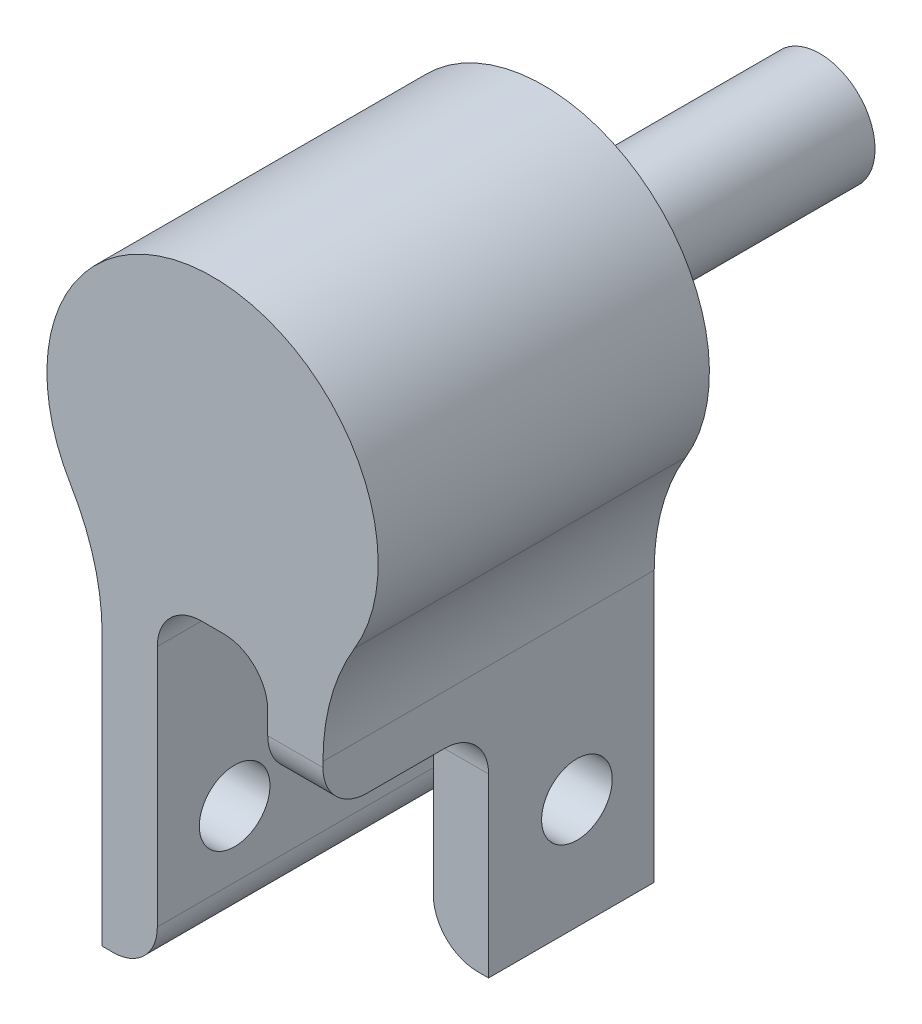
from build123d import *

# Parameters (mm, degrees)
BOSS_EXTRUDE1_DEPTH = 15
FILLET1_R           = 10
SKETCH3_R           = 2.5
BOSS_EXTRUDE2_DEPTH = 12.5
CUT_EXTRUDE4_REACH  = 30.862
SKETCH7_W           = 7.5
SKETCH7_H           = 10
CUT_EXTRUDE7_REACH  = 30.862
SKETCH10_R          = 1.6
SKETCH9_R           = 1.6
CUT_EXTRUDE8_DEPTH  = 29.861852882
FILLET2_R           = 2
FILLET3_R           = 1
FILLET4_R           = 2


with BuildPart() as part:
    # Sketch2 → Boss-Extrude1 (new body)
    with BuildSketch(Plane.XY):
        with BuildLine():
            Line((-2.5, -6.254565433), (-2.5, -21.254565433))
            Line((-2.5, -21.254565433), (-5, -21.254565433))
            Line((-5, -21.254565433), (-5, -6.254565433))
            Line((-5, -6.254565433), (-5, -5.590169944))
            ThreePointArc((-5, -5.590169944), (0, 7.5), (5, -5.590169944))
            Line((5, -5.590169944), (5, -6.254565433))
            Line((5, -6.254565433), (5, -21.254565433))
            Line((5, -21.254565433), (2.5, -21.254565433))
            Line((2.5, -21.254565433), (2.5, -6.254565433))
            Line((2.5, -6.254565433), (-2.5, -6.254565433))
        make_face()
    extrude(amount=BOSS_EXTRUDE1_DEPTH)

    # Fillet1
    fillet1_edges = [part.edges().sort_by_distance(p)[0] for p in [
        (-5, -5.590169944, 7.5),
        (5, -5.590169944, 7.5),
    ]]
    fillet(fillet1_edges, radius=FILLET1_R)

    # Sketch3 → Boss-Extrude2 (add)
    with BuildSketch(Plane(origin=(0, 0, 0), x_dir=(-1, 0, 0), z_dir=(0, 0, -1))):
        Circle(SKETCH3_R)
    extrude(amount=BOSS_EXTRUDE2_DEPTH)

    # Sketch7 → Cut-Extrude4 (cut, up to next)
    with BuildSketch(Plane(origin=(5, 0, 0), x_dir=(0, 0, -1), z_dir=(1, 0, 0)), mode=Mode.PRIVATE) as cut_extrude4_sk1:
        with Locations((-11.25, -16.254565433)):
            Rectangle(SKETCH7_W, SKETCH7_H)
    cut_extrude4_tool1 = extrude(cut_extrude4_sk1.sketch, amount=-CUT_EXTRUDE4_REACH, mode=Mode.PRIVATE) & part.part
    add(cut_extrude4_tool1.solids().sort_by_distance((5, -16.254565, 11.25))[0], mode=Mode.SUBTRACT)

    # Sketch10 → Cut-Extrude7 (cut, up to next)
    with BuildSketch(Plane.ZY.offset(5), mode=Mode.PRIVATE) as cut_extrude7_sk1:
        with Locations((11.5, -16.254565433)):
            Circle(SKETCH10_R)
    cut_extrude7_tool1 = extrude(cut_extrude7_sk1.sketch, amount=-CUT_EXTRUDE7_REACH, mode=Mode.PRIVATE) & part.part
    add(cut_extrude7_tool1.solids().sort_by_distance((-5, -16.254565, 11.5))[0], mode=Mode.SUBTRACT)

    # Sketch9 → Cut-Extrude8 (cut, through all)
    with BuildSketch(Plane.ZY.offset(5)):
        with Locations((3.5, -16.254565433)):
            Circle(SKETCH9_R)
    extrude(amount=-CUT_EXTRUDE8_DEPTH, mode=Mode.SUBTRACT)

    # Fillet2
    fillet2_edges = [part.edges().sort_by_distance(p)[0] for p in [
        (-2.5, -6.254565433, 7.5),
        (-2.5, -21.254565433, 7.5),
        (2.5, -6.254565433, 7.5),
        (2.5, -21.254565433, 3.75),
    ]]
    fillet(fillet2_edges, radius=FILLET2_R)

    # Fillet3
    fillet3_edges = [part.edges().sort_by_distance(p)[0] for p in [
        (2.5, 0, 0),
    ]]
    fillet(fillet3_edges, radius=FILLET3_R)

    # Fillet4
    fillet4_edges = [part.edges().sort_by_distance(p)[0] for p in [
        (3.75, -11.254565433, 15),
        (3.75, -11.254565433, 7.5),
    ]]
    fillet(fillet4_edges, radius=FILLET4_R)


solid = part.part
